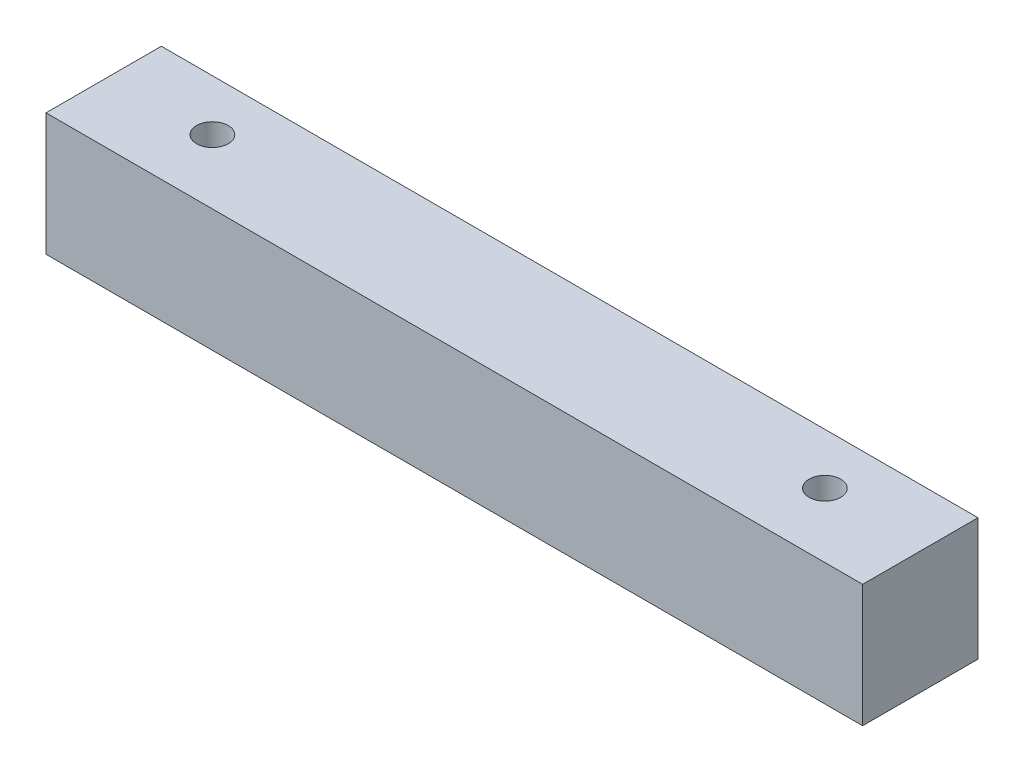
from build123d import *

# Parameters (mm, degrees)
SKETCH_1_W          = 80
SKETCH_1_H          = 12
EXTRUDE_1_DEPTH     = 11.5
CUT_EXTRUDE_1_REACH = 83.708
SKETCH_2_R          = 1.55
SKETCH_3_W          = 80
SKETCH_3_H          = 12
CUT_EXTRUDE_2_DEPTH = 0.2


with BuildPart() as part:
    # 草图1 → 凸台-拉伸1 (new body)
    with BuildSketch(Plane.XY):
        with Locations((40, 6)):
            Rectangle(SKETCH_1_W, SKETCH_1_H)
    extrude(amount=EXTRUDE_1_DEPTH)

    # 草图2 → 切除-拉伸1 (cut, up to next)
    with BuildSketch(Plane(origin=(0, 12, 0), x_dir=(1, 0, 0), z_dir=(0, 1, 0)), mode=Mode.PRIVATE) as cut_extrude_1_sk1:
        with Locations(Location((10, -5, 0), (0, 0, 270))):
            Circle(SKETCH_2_R)
    cut_extrude_1_tool1 = extrude(cut_extrude_1_sk1.sketch, amount=-CUT_EXTRUDE_1_REACH, mode=Mode.PRIVATE) & part.part
    # 草图2 → 切除-拉伸1 (cut, up to next)
    with BuildSketch(Plane(origin=(0, 12, 0), x_dir=(1, 0, 0), z_dir=(0, 1, 0)), mode=Mode.PRIVATE) as cut_extrude_1_sk2:
        with Locations(Location((70, -5, 0), (0, 0, 270))):
            Circle(SKETCH_2_R)
    cut_extrude_1_tool2 = extrude(cut_extrude_1_sk2.sketch, amount=-CUT_EXTRUDE_1_REACH, mode=Mode.PRIVATE) & part.part
    add(cut_extrude_1_tool1.solids().sort_by_distance((10, 12, 5))[0], mode=Mode.SUBTRACT)
    add(cut_extrude_1_tool2.solids().sort_by_distance((70, 12, 5))[0], mode=Mode.SUBTRACT)

    # 草图3 → 切除-拉伸2 (cut)
    with BuildSketch(Plane.XY.offset(11.5)):
        with Locations((40, 6)):
            Rectangle(SKETCH_3_W, SKETCH_3_H)
    extrude(amount=-CUT_EXTRUDE_2_DEPTH, mode=Mode.SUBTRACT)


solid = part.part
